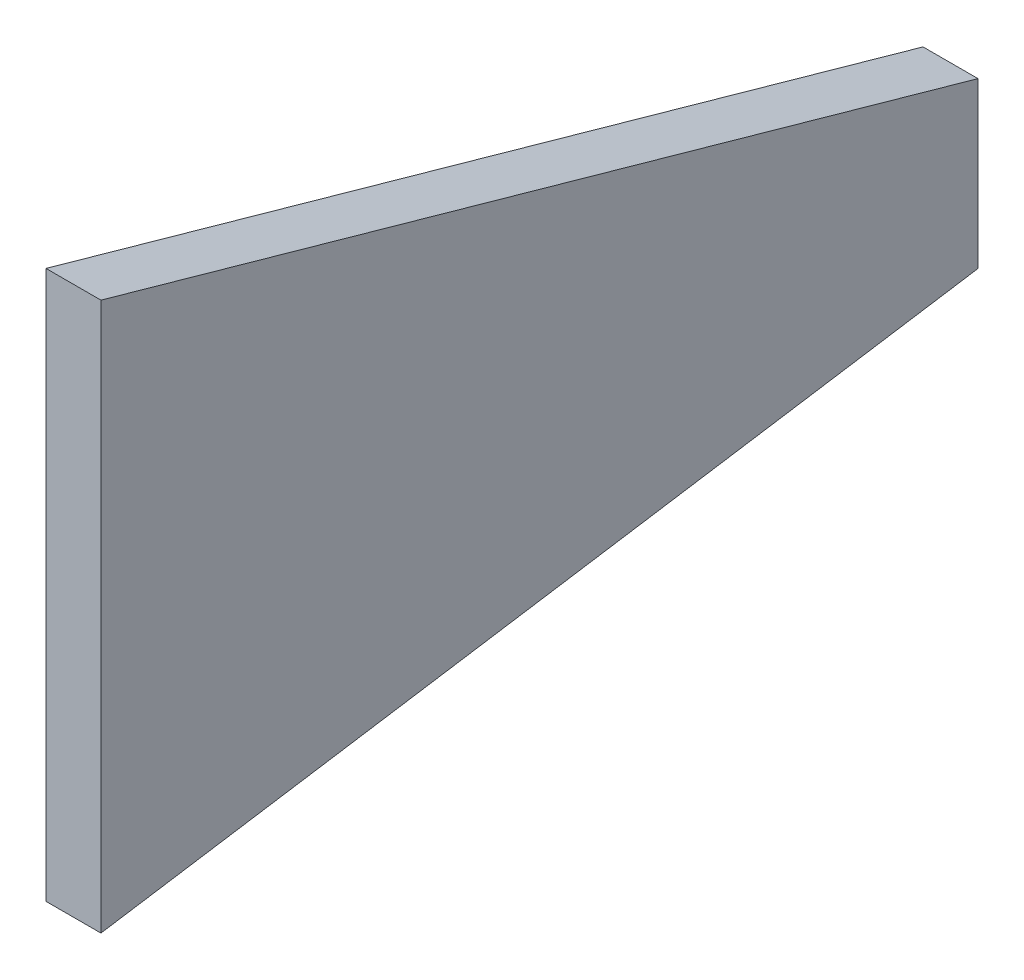
from build123d import *

# Parameters (mm, degrees)
BOSS_EXTRUDE1_DEPTH = 100
CUT_EXTRUDE2_DEPTH  = 65


with BuildPart() as part:
    # Sketch1 → Boss-Extrude1 (new body)
    with BuildSketch(Plane(origin=(0, 0, 0), x_dir=(1, 0, 0), z_dir=(0, 1, 0))):
        Polygon((-10, -150), (0, 0), (-10.022197586, 0), (-20.022197586, -150), align=None)
    extrude(amount=BOSS_EXTRUDE1_DEPTH)

    # Sketch3 → Cut-Extrude2 (cut)
    with BuildSketch(Plane(origin=(0, 0, 0), x_dir=(0, 0, -1), z_dir=(1, 0, 0))):
        Polygon((0, 65), (-150, 100), (0, 100), align=None)
        Polygon((0, 35), (-150, 0), (0, 0), align=None)
    extrude(amount=-CUT_EXTRUDE2_DEPTH, mode=Mode.SUBTRACT)


solid = part.part
